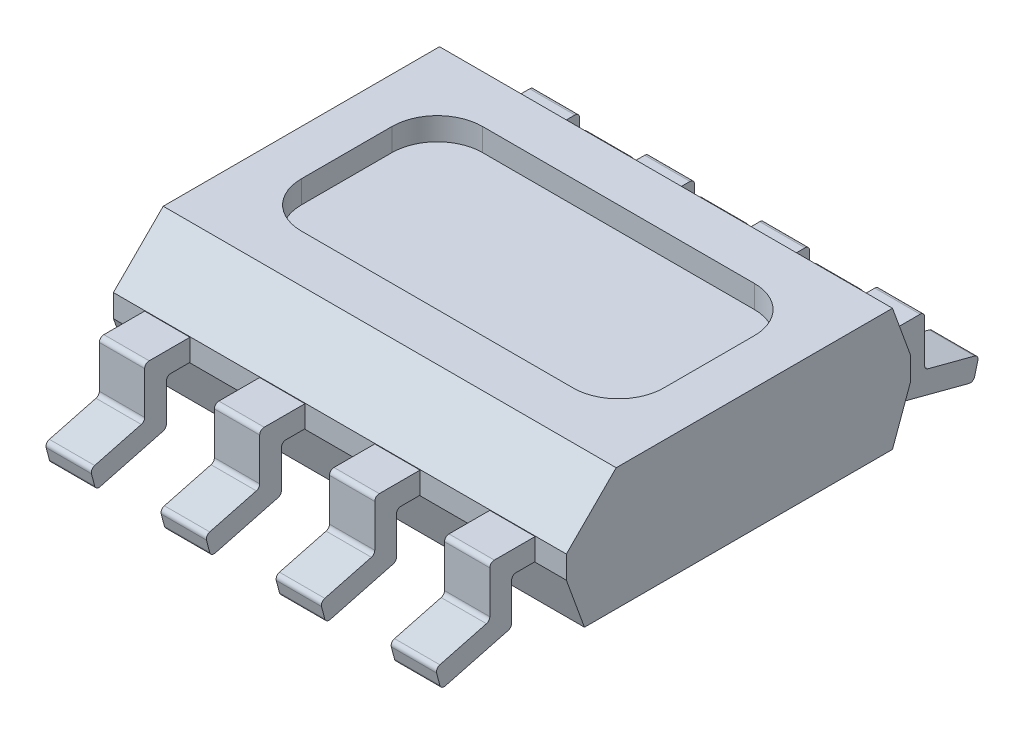
from build123d import *

# Parameters (mm, degrees)
SKETCH1_W            = 5
SKETCH1_H            = 3.8
BOSS_EXTRUDE1_DEPTH  = 1.35
CUT_EXTRUDE1_DEPTH   = 5
CUT_EXTRUDE2_DEPTH   = 0.25
BOSS_EXTRUDE2_DEPTH  = 0.25
LPATTERN1_COUNT      = 4
LPATTERN1_PITCH      = 1.27
MIRROR1_COPY_1_DEPTH = 0.25
MIRROR1_COPY_2_DEPTH = 0.25
MIRROR1_COPY_3_DEPTH = 0.25


with BuildPart() as part:
    # Sketch1 → Boss-Extrude1 (new body)
    with BuildSketch(Plane(origin=(0, 0, 0), x_dir=(1, 0, 0), z_dir=(0, 1, 0))):
        with Locations((2.5, 1.9)):
            Rectangle(SKETCH1_W, SKETCH1_H)
    extrude(amount=BOSS_EXTRUDE1_DEPTH)

    # Sketch2 → Cut-Extrude1 (cut)
    with BuildSketch(Plane(origin=(5, 0, 0), x_dir=(0, 0, -1), z_dir=(1, 0, 0))):
        Polygon((0, 0.8), (0.55, 1.35), (0, 1.35), align=None)
        Polygon((0.2, 0), (0, 0.55), (0, 0), align=None)
        Polygon((3.8, 0), (3.8, 0.55), (3.6, 0), align=None)
        Polygon((3.8, 1.35), (3.6, 1.35), (3.8, 0.8), align=None)
    extrude(amount=-CUT_EXTRUDE1_DEPTH, mode=Mode.SUBTRACT)

    # Sketch3 → Cut-Extrude2 (cut)
    with BuildSketch(Plane(origin=(0, 1.35, 0), x_dir=(1, 0, 0), z_dir=(0, 1, 0))):
        with BuildLine():
            Line((1, 3.075), (4, 3.075))
            ThreePointArc((4, 3.075), (4.353553391, 2.928553391), (4.5, 2.575))
            Line((4.5, 2.575), (4.5, 1.575))
            ThreePointArc((4.5, 1.575), (4.353553391, 1.221446609), (4, 1.075))
            Line((4, 1.075), (1, 1.075))
            ThreePointArc((1, 1.075), (0.646446609, 1.221446609), (0.5, 1.575))
            Line((0.5, 1.575), (0.5, 2.575))
            ThreePointArc((0.5, 2.575), (0.646446609, 2.928553391), (1, 3.075))
        make_face()
    extrude(amount=-CUT_EXTRUDE2_DEPTH, mode=Mode.SUBTRACT)

    # Sketch4 → Boss-Extrude2 (add, symmetric)
    with BuildSketch(Plane(origin=(4.405, 0, 0), x_dir=(0, 0, -1), z_dir=(1, 0, 0))):
        with BuildLine():
            Line((3.8, 0.795), (4.25, 0.795))
            ThreePointArc((4.25, 0.795), (4.285355339, 0.780355339), (4.3, 0.745))
            Line((4.3, 0.745), (4.3, 0.278551504))
            ThreePointArc((4.3, 0.278551504), (4.31040014, 0.248025269), (4.337274043, 0.230198118))
            Line((4.337274043, 0.230198118), (4.851646613, 0.094822214))
            ThreePointArc((4.851646613, 0.094822214), (4.882110274, 0.071661224), (4.887274043, 0.03374287))
            Line((4.887274043, 0.03374287), (4.851641362, -0.101646613))
            ThreePointArc((4.851641362, -0.101646613), (4.828480372, -0.132110274), (4.790562018, -0.137274043))
            Line((4.790562018, -0.137274043), (4.097274043, 0.045189976))
            ThreePointArc((4.097274043, 0.045189976), (4.07040014, 0.063017127), (4.06, 0.093543363))
            Line((4.06, 0.093543363), (4.06, 0.505))
            ThreePointArc((4.06, 0.505), (4.045355339, 0.540355339), (4.01, 0.555))
            Line((4.01, 0.555), (3.8, 0.555))
            Line((3.8, 0.555), (3.8, 0.795))
        make_face()
    boss_extrude2 = extrude(amount=BOSS_EXTRUDE2_DEPTH, both=True)

    # LPattern1: Boss-Extrude2 ×4
    with Locations(*[(-i * LPATTERN1_PITCH, 0, 0) for i in range(1, LPATTERN1_COUNT)]):
        add(boss_extrude2)

    # Mirror1: Boss-Extrude2 across plane
    add(boss_extrude2.mirror(Plane(origin=(0, 0, -1.9), x_dir=(1, 0, 0), z_dir=(0, 0, -1))))

    # Mirror1 copy 1 sketch → Mirror1 copy 1 (add, symmetric)
    with BuildSketch(Plane(origin=(3.135, 0, -3.8), x_dir=(0, 0, 1), z_dir=(1, 0, 0))):
        with BuildLine():
            Line((3.8, -0.795), (4.25, -0.795))
            ThreePointArc((4.25, -0.795), (4.285355339, -0.780355339), (4.3, -0.745))
            Line((4.3, -0.745), (4.3, -0.278551504))
            ThreePointArc((4.3, -0.278551504), (4.31040014, -0.248025269), (4.337274043, -0.230198118))
            Line((4.337274043, -0.230198118), (4.851646613, -0.094822214))
            ThreePointArc((4.851646613, -0.094822214), (4.882110274, -0.071661224), (4.887274043, -0.03374287))
            Line((4.887274043, -0.03374287), (4.851641362, 0.101646613))
            ThreePointArc((4.851641362, 0.101646613), (4.828480372, 0.132110274), (4.790562018, 0.137274043))
            Line((4.790562018, 0.137274043), (4.097274043, -0.045189976))
            ThreePointArc((4.097274043, -0.045189976), (4.07040014, -0.063017127), (4.06, -0.093543363))
            Line((4.06, -0.093543363), (4.06, -0.505))
            ThreePointArc((4.06, -0.505), (4.045355339, -0.540355339), (4.01, -0.555))
            Line((4.01, -0.555), (3.8, -0.555))
            Line((3.8, -0.555), (3.8, -0.795))
        make_face()
    extrude(amount=MIRROR1_COPY_1_DEPTH, both=True)

    # Mirror1 copy 2 sketch → Mirror1 copy 2 (add, symmetric)
    with BuildSketch(Plane(origin=(1.865, 0, -3.8), x_dir=(0, 0, 1), z_dir=(1, 0, 0))):
        with BuildLine():
            Line((3.8, -0.795), (4.25, -0.795))
            ThreePointArc((4.25, -0.795), (4.285355339, -0.780355339), (4.3, -0.745))
            Line((4.3, -0.745), (4.3, -0.278551504))
            ThreePointArc((4.3, -0.278551504), (4.31040014, -0.248025269), (4.337274043, -0.230198118))
            Line((4.337274043, -0.230198118), (4.851646613, -0.094822214))
            ThreePointArc((4.851646613, -0.094822214), (4.882110274, -0.071661224), (4.887274043, -0.03374287))
            Line((4.887274043, -0.03374287), (4.851641362, 0.101646613))
            ThreePointArc((4.851641362, 0.101646613), (4.828480372, 0.132110274), (4.790562018, 0.137274043))
            Line((4.790562018, 0.137274043), (4.097274043, -0.045189976))
            ThreePointArc((4.097274043, -0.045189976), (4.07040014, -0.063017127), (4.06, -0.093543363))
            Line((4.06, -0.093543363), (4.06, -0.505))
            ThreePointArc((4.06, -0.505), (4.045355339, -0.540355339), (4.01, -0.555))
            Line((4.01, -0.555), (3.8, -0.555))
            Line((3.8, -0.555), (3.8, -0.795))
        make_face()
    extrude(amount=MIRROR1_COPY_2_DEPTH, both=True)

    # Mirror1 copy 3 sketch → Mirror1 copy 3 (add, symmetric)
    with BuildSketch(Plane(origin=(0.595, 0, -3.8), x_dir=(0, 0, 1), z_dir=(1, 0, 0))):
        with BuildLine():
            Line((3.8, -0.795), (4.25, -0.795))
            ThreePointArc((4.25, -0.795), (4.285355339, -0.780355339), (4.3, -0.745))
            Line((4.3, -0.745), (4.3, -0.278551504))
            ThreePointArc((4.3, -0.278551504), (4.31040014, -0.248025269), (4.337274043, -0.230198118))
            Line((4.337274043, -0.230198118), (4.851646613, -0.094822214))
            ThreePointArc((4.851646613, -0.094822214), (4.882110274, -0.071661224), (4.887274043, -0.03374287))
            Line((4.887274043, -0.03374287), (4.851641362, 0.101646613))
            ThreePointArc((4.851641362, 0.101646613), (4.828480372, 0.132110274), (4.790562018, 0.137274043))
            Line((4.790562018, 0.137274043), (4.097274043, -0.045189976))
            ThreePointArc((4.097274043, -0.045189976), (4.07040014, -0.063017127), (4.06, -0.093543363))
            Line((4.06, -0.093543363), (4.06, -0.505))
            ThreePointArc((4.06, -0.505), (4.045355339, -0.540355339), (4.01, -0.555))
            Line((4.01, -0.555), (3.8, -0.555))
            Line((3.8, -0.555), (3.8, -0.795))
        make_face()
    extrude(amount=MIRROR1_COPY_3_DEPTH, both=True)


solid = part.part
